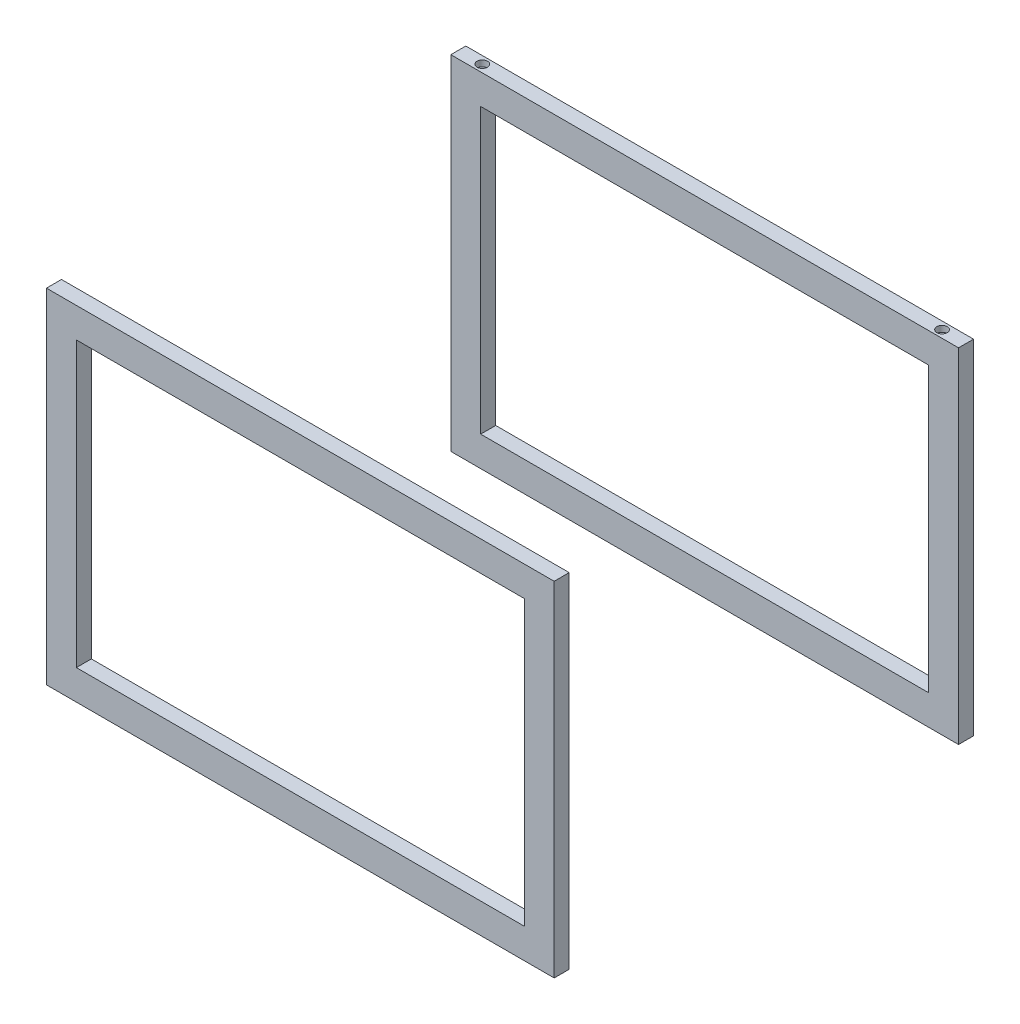
from build123d import *

# Parameters (mm, degrees)
ESQUISSE8_W             = 1695
ESQUISSE8_H             = 1147
ESQUISSE8_W_2           = 1495.38
ESQUISSE8_H_2           = 457.38
BOSS_EXTRU_8_DEPTH      = 50.13
ESQUISSE9_W             = 1695
ESQUISSE9_H             = 1147
ESQUISSE9_W_2           = 1495.38
ESQUISSE9_H_2           = 457.38
ESQUISSE9_W_3           = 280.38
ESQUISSE9_H_3           = 390.19
ESQUISSE9_W_4           = 425.38
ESQUISSE9_W_5           = 590
ESQUISSE9_H_4           = 58.19
BOSS_EXTRU_9_DEPTH      = 50.13
ESQUISSE12_W            = 1495.38
ESQUISSE12_H            = 490
ENL_V_MAT_EXTRU_1_DEPTH = 50.13
ESQUISSE13_W            = 1495.38
ESQUISSE13_H            = 947.38
ENL_V_MAT_EXTRU_2_DEPTH = 50.13
ESQUISSE14_R            = 17.5
ENL_V_MAT_EXTRU_3_DEPTH = 20


with BuildPart() as part:
    # Esquisse8 → Boss.-Extru.8 (new body)
    with BuildSketch(Plane.XY):
        with Locations((847.5, 573.5)):
            Rectangle(ESQUISSE8_W, ESQUISSE8_H)
        with Locations((847.5, 818.5)):
            Rectangle(ESQUISSE8_W_2, ESQUISSE8_H_2, mode=Mode.SUBTRACT)
    extrude(amount=BOSS_EXTRU_8_DEPTH)

    # Esquisse12 → Enlèv. mat.-Extru.1 (cut)
    with BuildSketch(Plane.XY.offset(50.13)):
        with Locations((847.5, 344.81)):
            Rectangle(ESQUISSE12_W, ESQUISSE12_H)
    extrude(amount=-ENL_V_MAT_EXTRU_1_DEPTH, mode=Mode.SUBTRACT)

    # Esquisse14 → Enlèv. mat.-Extru.3 (cut)
    with BuildSketch(Plane(origin=(0, 1147, 0), x_dir=(1, 0, 0), z_dir=(0, 1, 0))):
        with Locations(Location((1615, -25.065, 0), (0, 0, 270))):
            Circle(ESQUISSE14_R)
        with Locations(Location((80, -25.065, 0), (0, 0, 90))):
            Circle(ESQUISSE14_R)
    extrude(amount=-ENL_V_MAT_EXTRU_3_DEPTH, mode=Mode.SUBTRACT)


with BuildPart() as body_2:
    # Esquisse9 → Boss.-Extru.9 (new body)
    # profile 1 of 2: a face of its own
    with BuildSketch(Plane(origin=(0, 0, 1400), x_dir=(-1, 0, 0), z_dir=(0, 0, -1))):
        with Locations((-847.5, 573.5)):
            Rectangle(ESQUISSE9_W, ESQUISSE9_H)
        with Locations((-847.5, 818.5)):
            Rectangle(ESQUISSE9_W_2, ESQUISSE9_H_2, mode=Mode.SUBTRACT)
        with Locations((-1455, 294.905)):
            Rectangle(ESQUISSE9_W_3, ESQUISSE9_H_3, mode=Mode.SUBTRACT)
        with Locations((-1002.31, 294.905)):
            Rectangle(ESQUISSE9_W_4, ESQUISSE9_H_3, mode=Mode.SUBTRACT)
        with Locations((-394.81, 294.905)):
            Rectangle(ESQUISSE9_W_5, ESQUISSE9_H_3, mode=Mode.SUBTRACT)
    # profile 2 of 2: a face of its own
    with BuildSketch(Plane(origin=(0, 0, 1400), x_dir=(-1, 0, 0), z_dir=(0, 0, -1))):
        with Locations((-1002.31, 460.905)):
            Rectangle(ESQUISSE9_W_4, ESQUISSE9_H_4)
    extrude(amount=BOSS_EXTRU_9_DEPTH)

    # Esquisse13 → Enlèv. mat.-Extru.2 (cut)
    with BuildSketch(Plane.XY.offset(1400)):
        with Locations((847.5, 573.5)):
            Rectangle(ESQUISSE13_W, ESQUISSE13_H)
    extrude(amount=-ENL_V_MAT_EXTRU_2_DEPTH, mode=Mode.SUBTRACT)


solid = Compound([part.part, body_2.part])
